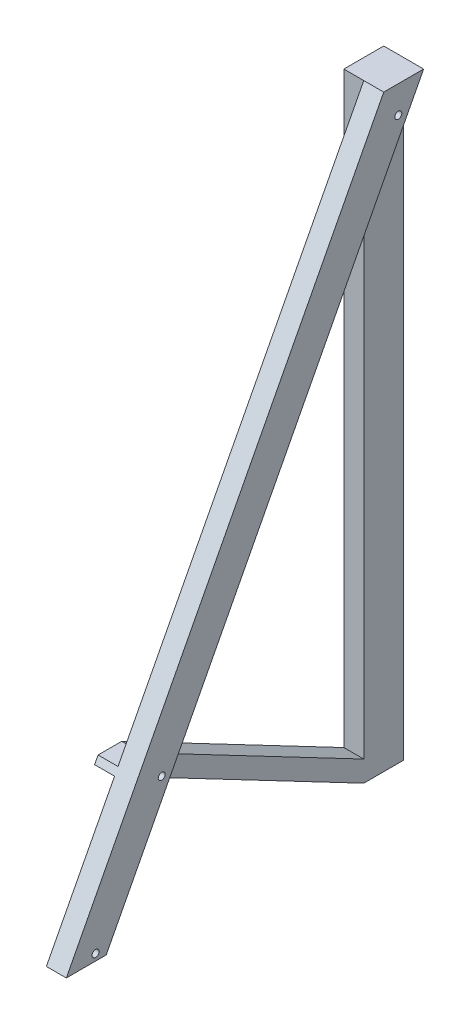
from build123d import *

# Parameters (mm, degrees)
BOSS_EXTRUDE1_DEPTH = 25.4
SKETCH2_R           = 4.389630664
BOSS_EXTRUDE4_DEPTH = 25.4
CUT_EXTRUDE1_START  = -25.4
SKETCH4_R           = 4.389630664
CUT_EXTRUDE1_DEPTH  = 25.4
SKETCH6_R           = 4.445
CUT_EXTRUDE2_DEPTH  = 25.4
SKETCH7_W           = 50.8
SKETCH7_H           = 774.7
BOSS_EXTRUDE5_DEPTH = 25.4
SKETCH8_R           = 4.445
CUT_EXTRUDE3_DEPTH  = 50.8


with BuildPart() as part:
    # Sketch1 → Boss-Extrude1 (new body)
    with BuildSketch(Plane(origin=(0, 0, 0), x_dir=(0, 0, -1), z_dir=(1, 0, 0))):
        Polygon((-50.8, 774.7), (-454.899551596, 0), (-404.099551596, 0), (0, 774.7), align=None)
    extrude(amount=BOSS_EXTRUDE1_DEPTH)

    # Sketch2 → Boss-Extrude4 (add)
    with BuildSketch(Plane(origin=(0, 0, 0), x_dir=(0, 0, -1), z_dir=(1, 0, 0))):
        Polygon((0, 0), (-333.48251995, 174.895038051), (-363.670680481, 174.895038051), (-368.098145545, 166.407136563), (-50.8, 0), align=None)
        with Locations((-333.48251995, 161.772531454)):
            Circle(SKETCH2_R, mode=Mode.SUBTRACT)
    extrude(amount=-BOSS_EXTRUDE4_DEPTH)

    # Sketch4 → Cut-Extrude1 (cut)
    with BuildSketch(Plane.ZY.offset(CUT_EXTRUDE1_START)):
        with Locations(Location((333.48251995, 161.772531454, 0), (0, 0, 180))):
            Circle(SKETCH4_R)
    extrude(amount=CUT_EXTRUDE1_DEPTH, mode=Mode.SUBTRACT)

    # Sketch6 → Cut-Extrude2 (cut)
    with BuildSketch(Plane.ZY):
        with Locations((417.660059318, 8.400584223)):
            Circle(SKETCH6_R)
    extrude(amount=-CUT_EXTRUDE2_DEPTH, mode=Mode.SUBTRACT)

    # Sketch7 → Boss-Extrude5 (add)
    with BuildSketch(Plane.ZY):
        with Locations((25.4, 387.35)):
            Rectangle(SKETCH7_W, SKETCH7_H)
    extrude(amount=BOSS_EXTRUDE5_DEPTH)

    # Sketch8 → Cut-Extrude3 (cut)
    with BuildSketch(Plane(origin=(25.4, 0, 0), x_dir=(0, 0, -1), z_dir=(1, 0, 0))):
        with Locations((-32.253882692, 739.883035965)):
            Circle(SKETCH8_R)
    extrude(amount=-CUT_EXTRUDE3_DEPTH, mode=Mode.SUBTRACT)


solid = part.part
